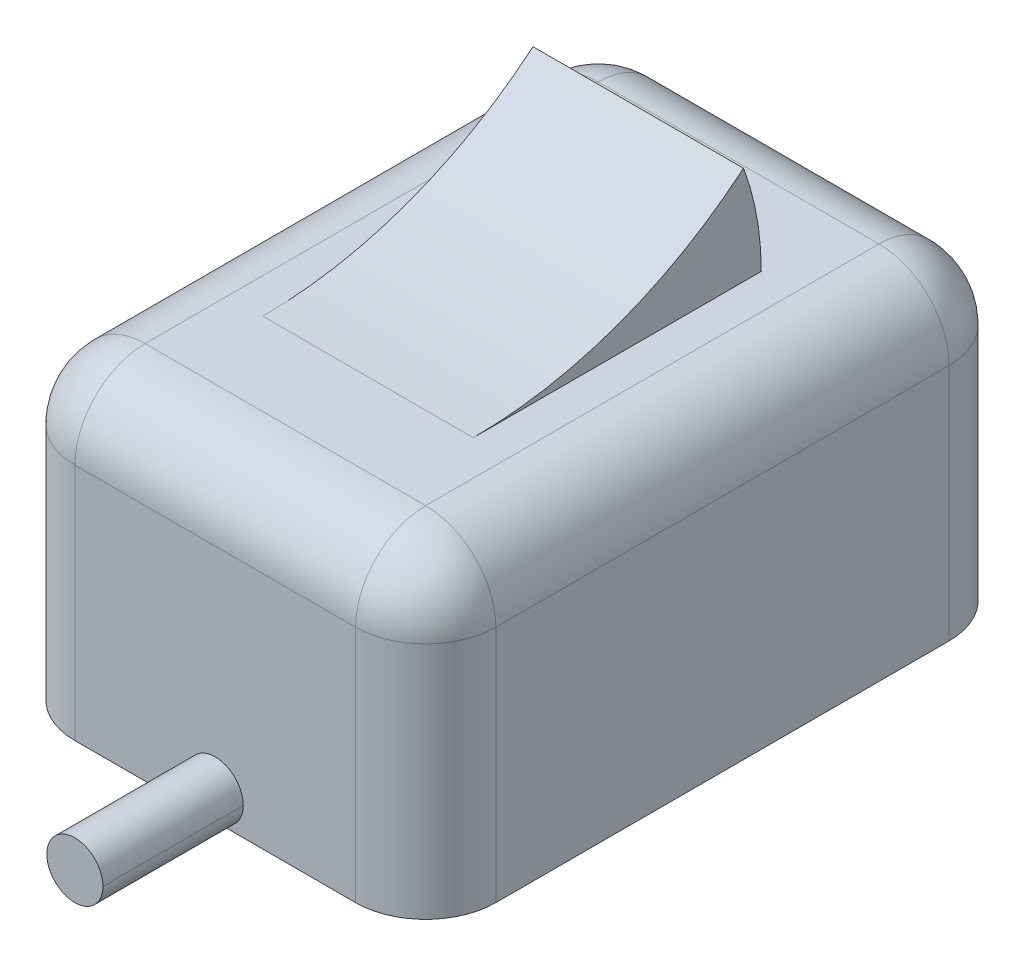
from build123d import *

# Parameters (mm, degrees)
SKETCH1_W           = 30
SKETCH1_H           = 42.3
BOSS_EXTRUDE1_DEPTH = 22
SKETCH2_R           = 2
BOSS_EXTRUDE2_DEPTH = 10
FILLET2_R           = 5
BOSS_EXTRUDE4_DEPTH = 30
CUT_EXTRUDE1_DEPTH  = 7.5
CUT_EXTRUDE2_START  = -7.5
CUT_EXTRUDE2_DEPTH  = 7.5


with BuildPart() as part:
    # Sketch1 → Boss-Extrude1 (new body)
    with BuildSketch(Plane(origin=(0, 0, 0), x_dir=(1, 0, 0), z_dir=(0, 1, 0))):
        with Locations((15, 21.15)):
            Rectangle(SKETCH1_W, SKETCH1_H)
    extrude(amount=BOSS_EXTRUDE1_DEPTH)

    # Sketch2 → Boss-Extrude2 (add)
    with BuildSketch(Plane.XY):
        with Locations(Location((15, 2, 0), (0, 0, 270))):
            Circle(SKETCH2_R)
    extrude(amount=BOSS_EXTRUDE2_DEPTH)

    # Fillet2
    fillet2_edges = [part.edges().sort_by_distance(p)[0] for p in [
        (30, 22, -21.15),
        (15, 22, -42.3),
        (0, 22, -21.15),
        (0, 11, -42.3),
        (30, 11, -42.3),
        (30, 11, 0),
        (0, 11, 0),
        (15, 22, 0),
    ]]
    fillet(fillet2_edges, radius=FILLET2_R)

    # Sketch5 → Boss-Extrude4 (add)
    with BuildSketch(Plane(origin=(0, 0, 0), x_dir=(0, 0, -1), z_dir=(1, 0, 0))):
        with BuildLine():
            Line((10.886815905, 22), (31.413184095, 22))
            ThreePointArc((31.413184095, 22), (31.094391882, 25.55669229), (30.14817809, 29))
            ThreePointArc((30.14817809, 29), (21.133767679, 23.804255316), (10.886815905, 22))
        make_face()
    extrude(amount=BOSS_EXTRUDE4_DEPTH)

    # Sketch6 → Cut-Extrude1 (cut)
    with BuildSketch(Plane.ZY):
        with BuildLine():
            Line((-10.886815905, 22), (-31.413184095, 22))
            ThreePointArc((-31.413184095, 22), (-31.094391882, 25.55669229), (-30.14817809, 29))
            ThreePointArc((-30.14817809, 29), (-21.133767679, 23.804255316), (-10.886815905, 22))
        make_face()
    extrude(amount=-CUT_EXTRUDE1_DEPTH, mode=Mode.SUBTRACT)

    # Sketch7 → Cut-Extrude2 (cut)
    with BuildSketch(Plane(origin=(30, 0, 0), x_dir=(0, 0, -1), z_dir=(1, 0, 0)).offset(CUT_EXTRUDE2_START)):
        with BuildLine():
            Line((10.886815905, 22), (31.413184095, 22))
            ThreePointArc((31.413184095, 22), (31.094391882, 25.55669229), (30.14817809, 29))
            ThreePointArc((30.14817809, 29), (21.133767679, 23.804255316), (10.886815905, 22))
        make_face()
    extrude(amount=CUT_EXTRUDE2_DEPTH, mode=Mode.SUBTRACT)


solid = part.part
